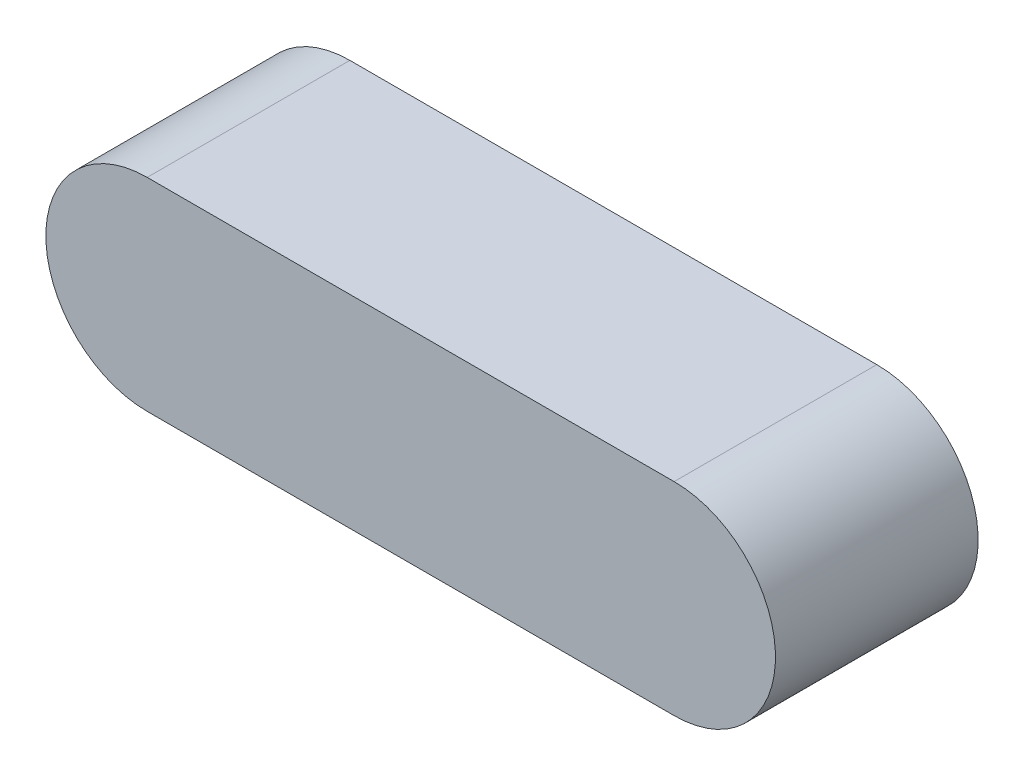
from build123d import *

# Parameters (mm, degrees)
EXTRUSION1_DEPTH = 5


with BuildPart() as part:
    # Esquisse1 → Extrusion1 (new body)
    with BuildSketch(Plane.XY):
        with BuildLine():
            Line((0, 0), (13, 0))
            ThreePointArc((13, 0), (15.5, -2.5), (13, -5))
            Line((13, -5), (0, -5))
            ThreePointArc((0, -5), (-2.5, -2.5), (0, 0))
        make_face()
    extrude(amount=EXTRUSION1_DEPTH)


solid = part.part
